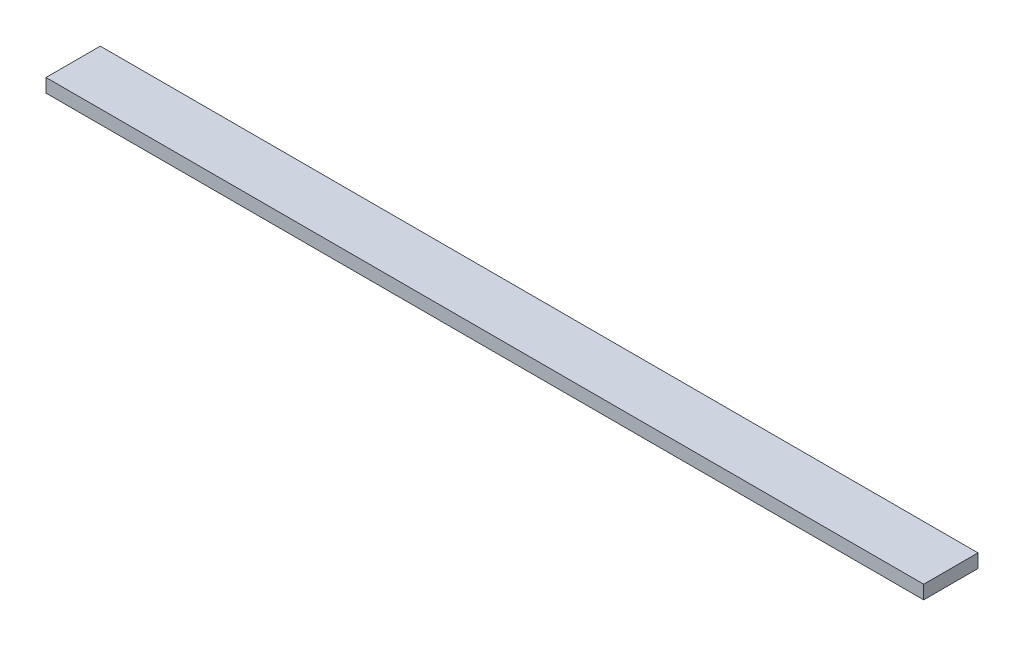
from build123d import *

# Parameters (mm, degrees)
SKETCH1_W           = 194
SKETCH1_H           = 12
BOSS_EXTRUDE1_DEPTH = 3


with BuildPart() as part:
    # Sketch1 → Boss-Extrude1 (new body)
    with BuildSketch(Plane(origin=(0, 0, 0), x_dir=(1, 0, 0), z_dir=(0, 1, 0))):
        with Locations((97, 6)):
            Rectangle(SKETCH1_W, SKETCH1_H)
    extrude(amount=BOSS_EXTRUDE1_DEPTH)


solid = part.part
